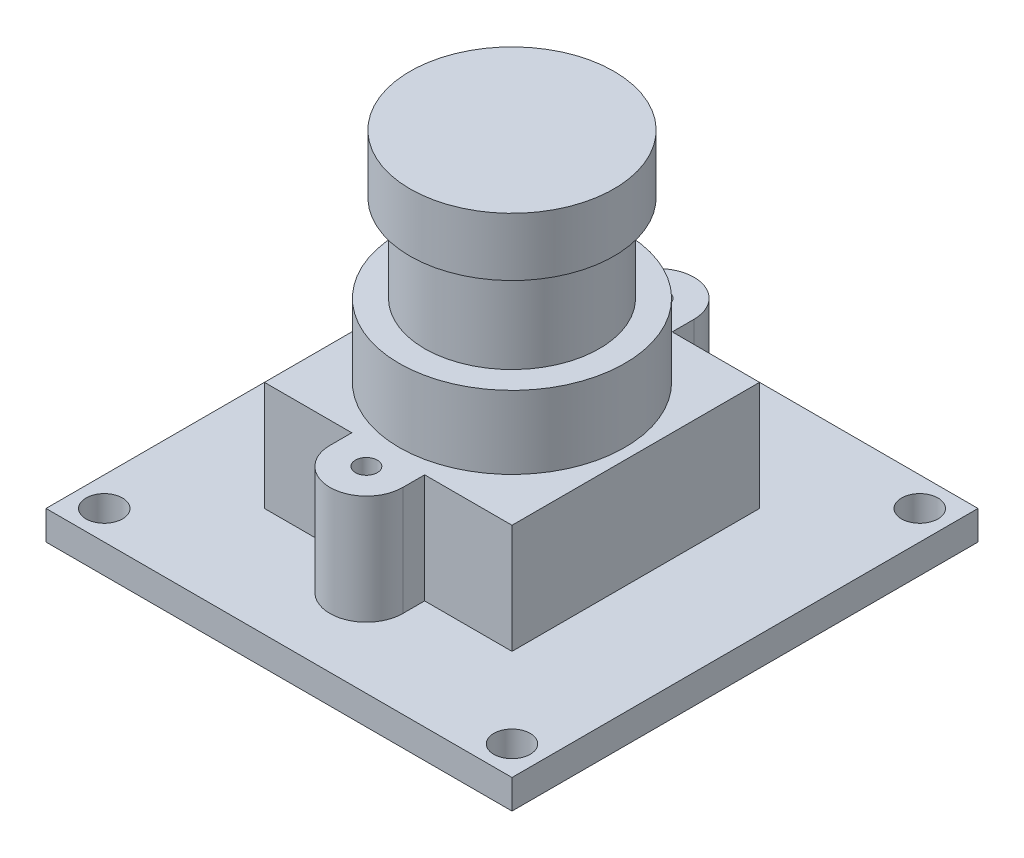
from build123d import *

# Parameters (mm, degrees)
SKETCH_1_W      = 32
SKETCH_1_H      = 32
SKETCH_1_R      = 1.25
EXTRUDE_1_DEPTH = 2
SKETCH_2_R      = 0.75
EXTRUDE_2_DEPTH = 7.5
SKETCH_3_R      = 7.75
EXTRUDE_3_DEPTH = 5
SKETCH_4_R      = 6
EXTRUDE_4_DEPTH = 6
SKETCH_5_R      = 7
EXTRUDE_5_DEPTH = 4


with BuildPart() as part:
    # 草图1 → 凸台-拉伸1 (new body)
    with BuildSketch(Plane(origin=(0, 0, 0), x_dir=(1, 0, 0), z_dir=(0, 1, 0))):
        Rectangle(SKETCH_1_W, SKETCH_1_H)
        with Locations(Location((-14, 14, 0), (0, 0, 270))):
            Circle(SKETCH_1_R, mode=Mode.SUBTRACT)
        with Locations(Location((14, 14, 0), (0, 0, 270))):
            Circle(SKETCH_1_R, mode=Mode.SUBTRACT)
        with Locations(Location((14, -14, 0), (0, 0, 270))):
            Circle(SKETCH_1_R, mode=Mode.SUBTRACT)
        with Locations(Location((-14, -14, 0), (0, 0, 270))):
            Circle(SKETCH_1_R, mode=Mode.SUBTRACT)
    extrude(amount=EXTRUDE_1_DEPTH)

    # 草图2 → 凸台-拉伸2 (add)
    with BuildSketch(Plane(origin=(0, 2, 0), x_dir=(1, 0, 0), z_dir=(0, 1, 0))):
        with BuildLine():
            Line((-2.5, -10), (-2.5, -8.5))
            Line((-2.5, -8.5), (-8.5, -8.5))
            Line((-8.5, -8.5), (-8.5, 8.5))
            Line((-8.5, 8.5), (-2.5, 8.5))
            Line((-2.5, 8.5), (-2.5, 10))
            ThreePointArc((-2.5, 10), (0, 12.5), (2.5, 10))
            Line((2.5, 10), (2.5, 8.5))
            Line((2.5, 8.5), (8.5, 8.5))
            Line((8.5, 8.5), (8.5, -8.5))
            Line((8.5, -8.5), (2.5, -8.5))
            Line((2.5, -8.5), (2.5, -10))
            ThreePointArc((2.5, -10), (0, -12.5), (-2.5, -10))
        make_face()
        with Locations(Location((0, 10, 0), (0, 0, 270))):
            Circle(SKETCH_2_R, mode=Mode.SUBTRACT)
        with Locations(Location((0, -10, 0), (0, 0, 270))):
            Circle(SKETCH_2_R, mode=Mode.SUBTRACT)
    extrude(amount=EXTRUDE_2_DEPTH)

    # 草图3 → 凸台-拉伸3 (add)
    with BuildSketch(Plane(origin=(0, 9.5, 0), x_dir=(1, 0, 0), z_dir=(0, 1, 0))):
        with Locations(Location((0, 0, 0), (0, 0, 270))):
            Circle(SKETCH_3_R)
    extrude(amount=EXTRUDE_3_DEPTH)

    # 草图4 → 凸台-拉伸4 (add)
    with BuildSketch(Plane(origin=(0, 14.5, 0), x_dir=(1, 0, 0), z_dir=(0, 1, 0))):
        with Locations(Location((0, 0, 0), (0, 0, 270))):
            Circle(SKETCH_4_R)
    extrude(amount=EXTRUDE_4_DEPTH)

    # 草图5 → 凸台-拉伸5 (add)
    with BuildSketch(Plane(origin=(0, 20.5, 0), x_dir=(1, 0, 0), z_dir=(0, 1, 0))):
        with Locations(Location((0, 0, 0), (0, 0, 270))):
            Circle(SKETCH_5_R)
    extrude(amount=EXTRUDE_5_DEPTH)


solid = part.part
